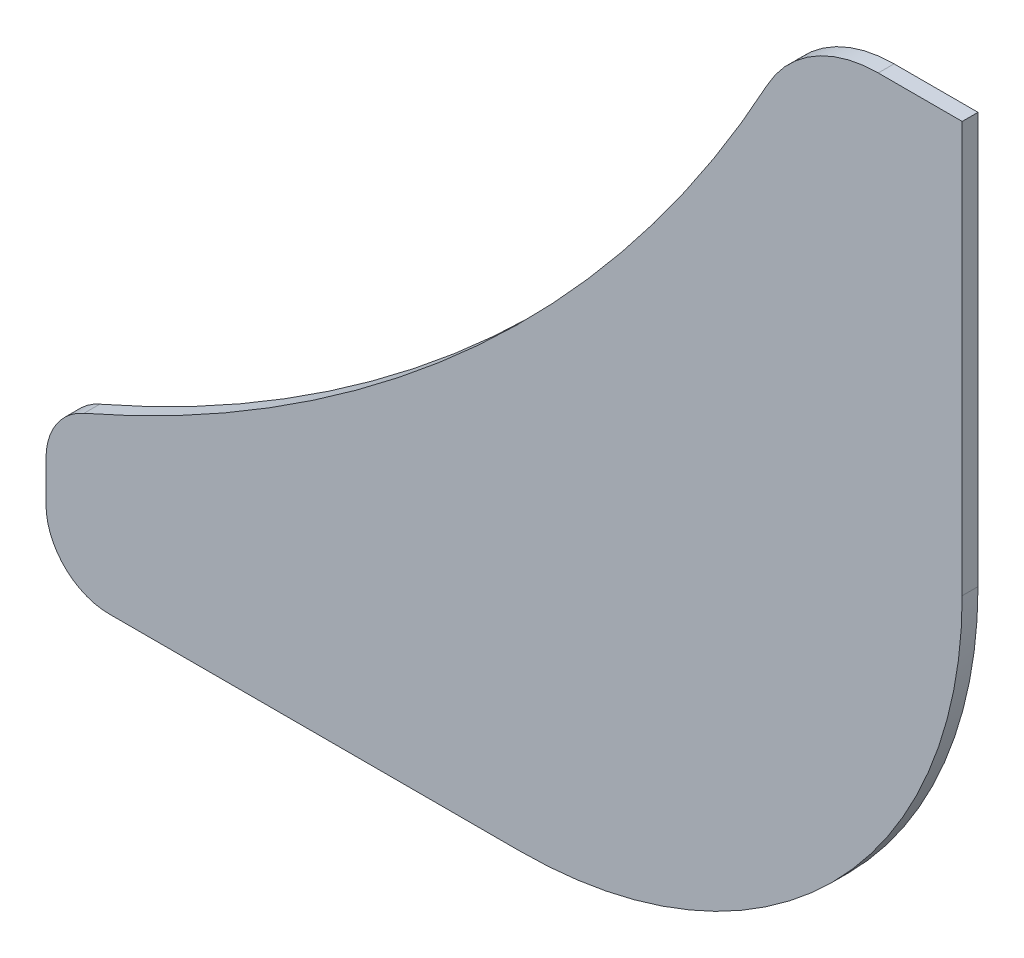
from build123d import *

# Parameters (mm, degrees)
BOSS_EXTRUDE1_DEPTH = 6.35
FILLET1_R           = 25.4


with BuildPart() as part:
    # Sketch1 → Boss-Extrude1 (new body)
    with BuildSketch(Plane.XY):
        with BuildLine():
            Line((203.2, -228.6), (203.2, -261.62))
            ThreePointArc((203.2, -261.62), (210.639487758, -279.580512242), (228.6, -287.02))
            Line((228.6, -287.02), (393.671225938, -287.02))
            ThreePointArc((393.671225938, -287.02), (519.394811633, -234.943585695), (571.471225938, -109.22))
            Line((571.471225938, -109.22), (571.471225938, 55.88))
            Line((571.471225938, 55.88), (537.728452035, 55.88))
            ThreePointArc((537.728452035, 55.88), (511.766359552, 48.744742687), (493.097424953, 29.343376138))
            ThreePointArc((493.097424953, 29.343376138), (370.666792044, -124.935933237), (203.2, -228.6))
        make_face()
    extrude(amount=BOSS_EXTRUDE1_DEPTH)

    # Fillet1
    fillet1_edges = [part.edges().sort_by_distance(p)[0] for p in [
        (203.2, -228.6, 3.175),
    ]]
    fillet(fillet1_edges, radius=FILLET1_R)


solid = part.part
